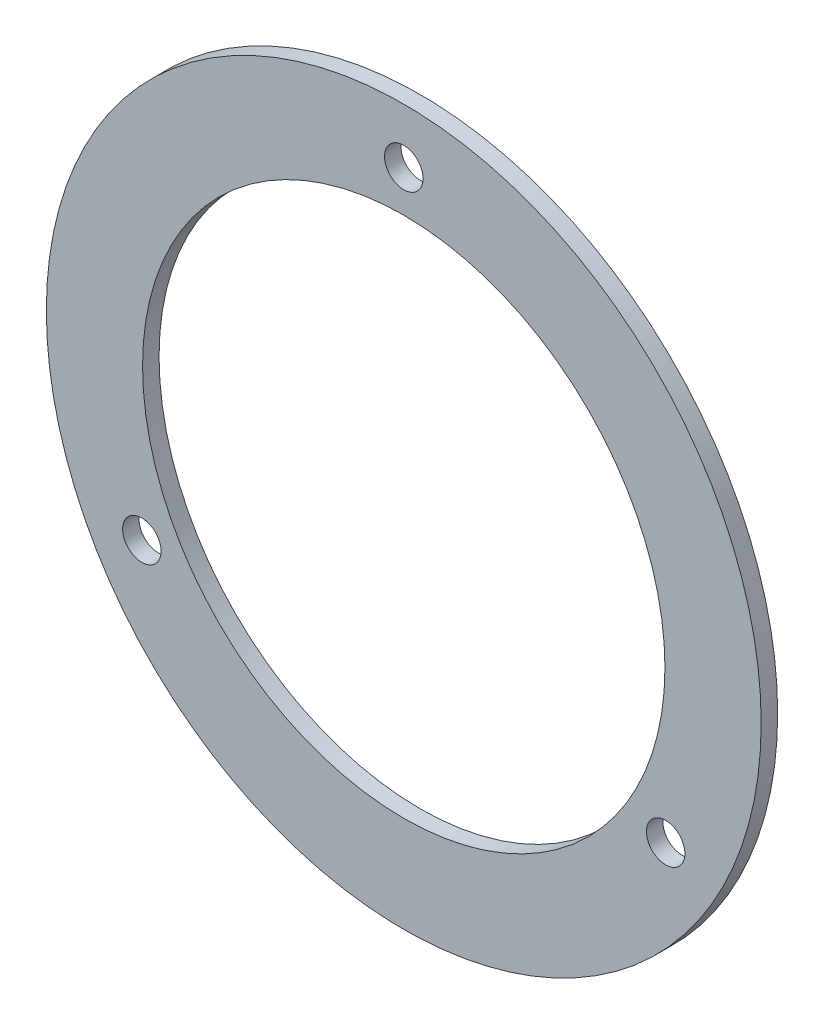
from build123d import *

# Parameters (mm, degrees)
SKETCH1_R           = 65
SKETCH1_R_2         = 47.5
BOSS_EXTRUDE1_DEPTH = 3
SKETCH2_R           = 3.5
CUT_EXTRUDE1_DEPTH  = 3
CIRPATTERN1_COUNT   = 3


with BuildPart() as part:
    # Sketch1 → Boss-Extrude1 (new body)
    with BuildSketch(Plane.XY):
        Circle(SKETCH1_R)
        Circle(SKETCH1_R_2, mode=Mode.SUBTRACT)
    extrude(amount=BOSS_EXTRUDE1_DEPTH)

    # Sketch2 → Cut-Extrude1 (cut)
    with BuildSketch(Plane.XY.offset(3)):
        with Locations((0, 55)):
            Circle(SKETCH2_R)
    cut_extrude1 = extrude(amount=-CUT_EXTRUDE1_DEPTH, mode=Mode.SUBTRACT)

    # CirPattern1: Cut-Extrude1 ×3 about axis
    cirpattern1_axis = Axis((0, 0, 0), (0, 0, 1))
    for i in range(1, CIRPATTERN1_COUNT):
        add(cut_extrude1.rotate(cirpattern1_axis, i * 360 / CIRPATTERN1_COUNT), mode=Mode.SUBTRACT)


solid = part.part
